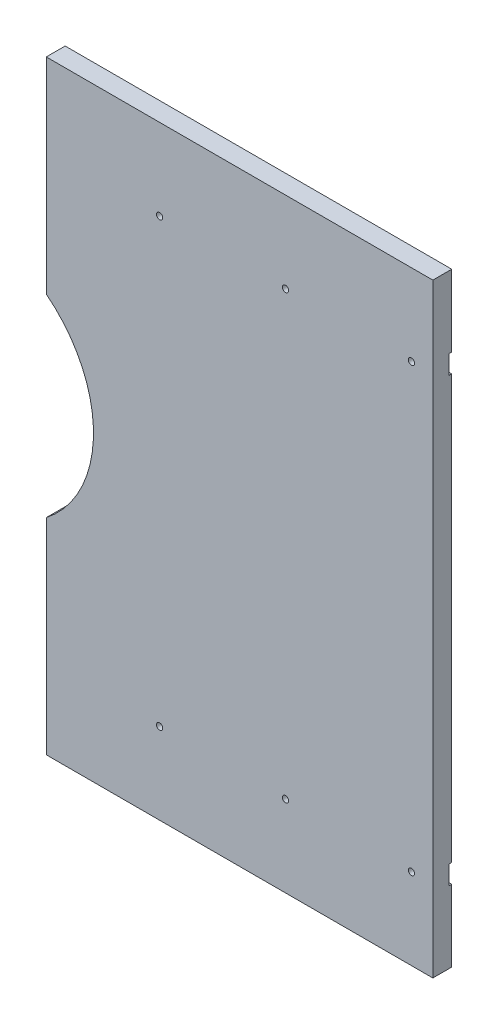
from build123d import *

# Parameters (mm, degrees)
SKETCH_1_W          = 307
SKETCH_1_H          = 480
EXTRUDE_1_DEPTH     = 15
SKETCH_2_W          = 307
SKETCH_2_H          = 15
CUT_EXTRUDE_1_DEPTH = 2
CUT_EXTRUDE_2_DEPTH = 286.284507115
HOLE_WIZARD_M6_1_D  = 5


with BuildPart() as part:
    # 草图1 → 凸台-拉伸1 (new body)
    with BuildSketch(Plane.XY):
        Rectangle(SKETCH_1_W, SKETCH_1_H)
    extrude(amount=EXTRUDE_1_DEPTH)

    # 草图2 → 切除-拉伸1 (cut)
    with BuildSketch(Plane(origin=(0, 0, 0), x_dir=(-1, 0, 0), z_dir=(0, 0, -1))):
        with Locations((0, 175.5)):
            Rectangle(SKETCH_2_W, SKETCH_2_H)
        with Locations((0, -175.5)):
            Rectangle(SKETCH_2_W, SKETCH_2_H)
    extrude(amount=-CUT_EXTRUDE_1_DEPTH, mode=Mode.SUBTRACT)

    # 草图3 → 切除-拉伸2 (cut, through all)
    with BuildSketch(Plane(origin=(0, 0, 0), x_dir=(-1, 0, 0), z_dir=(0, 0, -1))):
        with BuildLine():
            ThreePointArc((153.5, -76.852130745), (256.256578441, -87.624910842), (311, 0))
            ThreePointArc((311, 0), (256.256578441, 87.624910842), (153.5, 76.852130745))
            Line((153.5, 76.852130745), (153.5, -76.852130745))
        make_face()
        with BuildLine():
            Line((153.5, -76.852130745), (153.5, 76.852130745))
            ThreePointArc((153.5, 76.852130745), (116, 0), (153.5, -76.852130745))
        make_face()
    extrude(amount=-CUT_EXTRUDE_2_DEPTH, mode=Mode.SUBTRACT)

    # M6 螺纹孔1 (through all)
    with Locations(Plane(origin=(0, 0, 2), x_dir=(-1, 0, 0), z_dir=(0, 0, -1))):
        with Locations((63.5, -175.5), (-36.5, -175.5), (-136.5, -175.5), (-136.5, 175.5), (-36.5, 175.5), (63.5, 175.5)):
            Hole(HOLE_WIZARD_M6_1_D / 2)


solid = part.part
